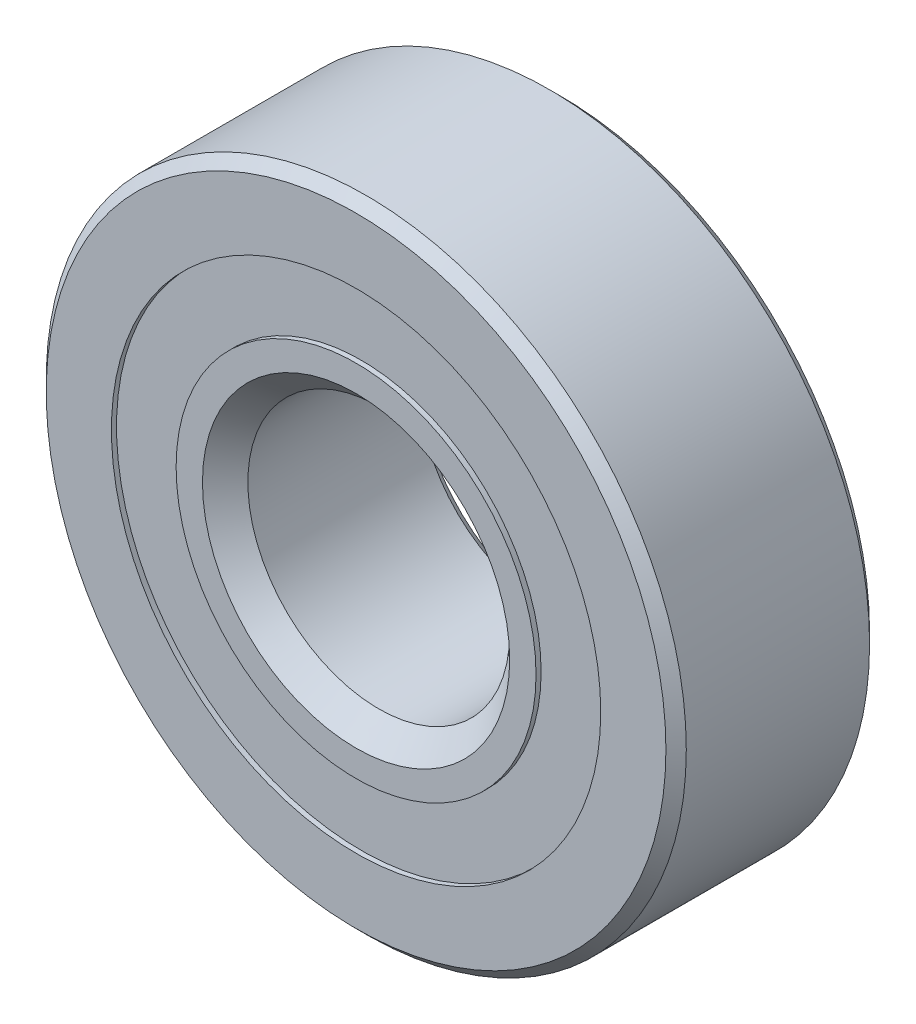
from build123d import *

# Parameters (mm, degrees)
CIRPATTERN1_COUNT = 12
SKETCH5_W         = 2.596321981
SKETCH5_H         = 3.530427575


with BuildPart() as part:
    # Sketch1 → Revolve1 (revolve)
    with BuildSketch(Plane(origin=(0, 0, 0), x_dir=(0, 0, -1), z_dir=(1, 0, 0))):
        with BuildLine():
            Line((5.000625, 17.4625), (-5.000625, 17.4625))
            Line((-5.000625, 17.4625), (-5.55625, 16.906875))
            Line((-5.55625, 16.906875), (-5.55625, 13.349828297))
            Line((-5.55625, 13.349828297), (-2.469444444, 13.349828297))
            ThreePointArc((-2.469444444, 13.349828297), (0, 14.985240519), (2.469444444, 13.349828297))
            Line((2.469444444, 13.349828297), (5.55625, 13.349828297))
            Line((5.55625, 13.349828297), (5.55625, 16.906875))
            Line((5.55625, 16.906875), (5.000625, 17.4625))
        make_face()
    revolve(axis=Axis((0, 0, 5.55625), (0, 0, -1)))


with BuildPart() as body_2:
    # Sketch3 → Revolve3 (revolve)
    with BuildSketch(Plane(origin=(0, 0, 0), x_dir=(0, 0, -1), z_dir=(1, 0, 0))):
        with BuildLine():
            Line((-5.2784375, 9.541588222), (-4.119229019, 8.382379741))
            Line((-4.119229019, 8.382379741), (0, 8.382379741))
            Line((0, 8.382379741), (0, 9.621009481))
            ThreePointArc((0, 9.621009481), (1.480939651, 10.066931492), (2.469444444, 11.256421703))
            Line((2.469444444, 11.256421703), (5.55625, 11.256421703))
            Line((5.55625, 11.256421703), (5.55625, 7.699375))
            Line((5.55625, 7.699375), (5.000625, 7.14375))
            Line((5.000625, 7.14375), (-4.317620259, 7.14375))
            Line((-4.317620259, 7.14375), (-5.55625, 8.382379741))
            Line((-5.55625, 8.382379741), (-5.55625, 9.819400722))
            Line((-5.55625, 9.819400722), (-5.2784375, 9.819400722))
            Line((-5.2784375, 9.819400722), (-5.2784375, 9.541588222))
        make_face()
    revolve(axis=Axis((0, 0, 5.55625), (0, 0, -1)))


with BuildPart() as body_3:
    # Sketch4 → Revolve4 (revolve)
    with BuildSketch(Plane(origin=(0, 0, 0), x_dir=(0, 0, -1), z_dir=(1, 0, 0))):
        with BuildLine():
            Line((-2.682115519, 12.303125), (2.682115519, 12.303125))
            ThreePointArc((2.682115519, 12.303125), (0, 14.985240519), (-2.682115519, 12.303125))
        make_face()
    revolve(axis=Axis((0, 12.303125, 2.682115519), (0, 0, -1)))


with BuildPart() as cirpattern1_1:
    # CirPattern1: pattern copy
    add(body_3.part.rotate(Axis((0, 0, -5.55625), (0, 0, 1)), 1 * 360 / CIRPATTERN1_COUNT))


with BuildPart() as cirpattern1_2:
    # CirPattern1: pattern copy
    add(body_3.part.rotate(Axis((0, 0, -5.55625), (0, 0, 1)), 2 * 360 / CIRPATTERN1_COUNT))


with BuildPart() as cirpattern1_3:
    # CirPattern1: pattern copy
    add(body_3.part.rotate(Axis((0, 0, -5.55625), (0, 0, 1)), 3 * 360 / CIRPATTERN1_COUNT))


with BuildPart() as cirpattern1_4:
    # CirPattern1: pattern copy
    add(body_3.part.rotate(Axis((0, 0, -5.55625), (0, 0, 1)), 4 * 360 / CIRPATTERN1_COUNT))


with BuildPart() as cirpattern1_5:
    # CirPattern1: pattern copy
    add(body_3.part.rotate(Axis((0, 0, -5.55625), (0, 0, 1)), 5 * 360 / CIRPATTERN1_COUNT))


with BuildPart() as cirpattern1_6:
    # CirPattern1: pattern copy
    add(body_3.part.rotate(Axis((0, 0, -5.55625), (0, 0, 1)), 6 * 360 / CIRPATTERN1_COUNT))


with BuildPart() as cirpattern1_7:
    # CirPattern1: pattern copy
    add(body_3.part.rotate(Axis((0, 0, -5.55625), (0, 0, 1)), 7 * 360 / CIRPATTERN1_COUNT))


with BuildPart() as cirpattern1_8:
    # CirPattern1: pattern copy
    add(body_3.part.rotate(Axis((0, 0, -5.55625), (0, 0, 1)), 8 * 360 / CIRPATTERN1_COUNT))


with BuildPart() as cirpattern1_9:
    # CirPattern1: pattern copy
    add(body_3.part.rotate(Axis((0, 0, -5.55625), (0, 0, 1)), 9 * 360 / CIRPATTERN1_COUNT))


with BuildPart() as cirpattern1_10:
    # CirPattern1: pattern copy
    add(body_3.part.rotate(Axis((0, 0, -5.55625), (0, 0, 1)), 10 * 360 / CIRPATTERN1_COUNT))


with BuildPart() as cirpattern1_11:
    # CirPattern1: pattern copy
    add(body_3.part.rotate(Axis((0, 0, -5.55625), (0, 0, 1)), 11 * 360 / CIRPATTERN1_COUNT))


with BuildPart() as body_15:
    # Sketch5 → Revolve5 (revolve)
    with BuildSketch(Plane(origin=(0, 0, 0), x_dir=(0, 0, -1), z_dir=(1, 0, 0))):
        with Locations((-3.98027651, 11.584614509)):
            Rectangle(SKETCH5_W, SKETCH5_H)
        with Locations((3.98027651, 11.584614509)):
            Rectangle(SKETCH5_W, SKETCH5_H)
    revolve(axis=Axis((0, 0, 5.55625), (0, 0, -1)))


solid = Compound([part.part, body_2.part, body_3.part, cirpattern1_1.part, cirpattern1_2.part, cirpattern1_3.part, cirpattern1_4.part, cirpattern1_5.part, cirpattern1_6.part, cirpattern1_7.part, cirpattern1_8.part, cirpattern1_9.part, cirpattern1_10.part, cirpattern1_11.part, body_15.part])
